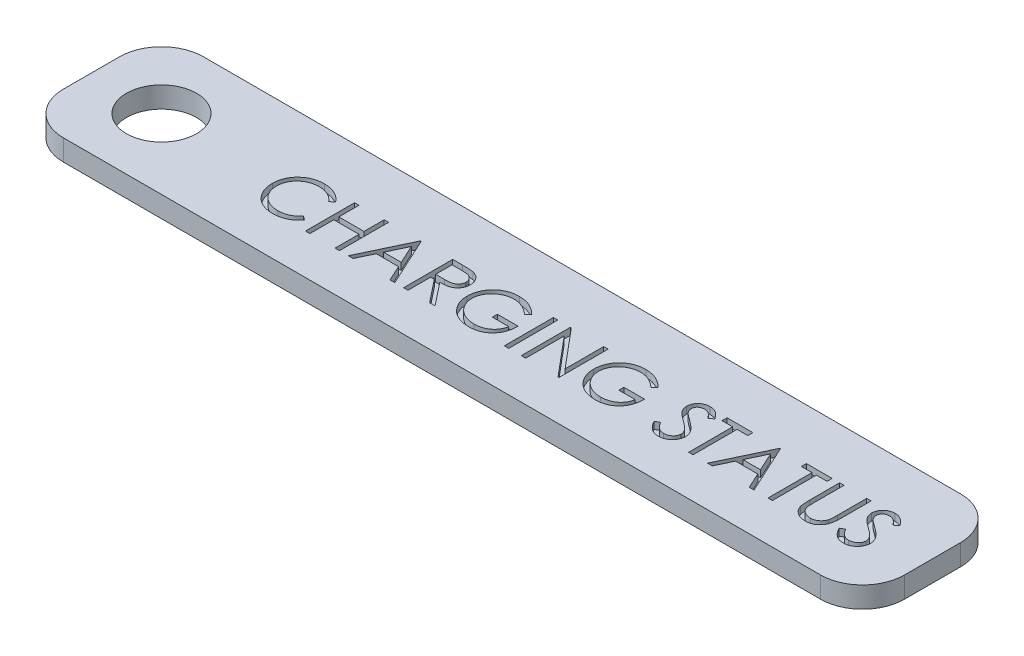
from build123d import *

# Parameters (mm, degrees)
SKETCH1_W           = 60
SKETCH1_H           = 10
BOSS_EXTRUDE1_DEPTH = 1.5
SKETCH4_W           = 0.314102564
SKETCH4_H           = 3.5
CUT_EXTRUDE2_DEPTH  = 0.5
SKETCH5_R           = 2.5
CUT_EXTRUDE3_DEPTH  = 10.5
FILLET1_R           = 3


with BuildPart() as part:
    # Sketch1 → Boss-Extrude1 (new body)
    with BuildSketch(Plane(origin=(0, 0, 0), x_dir=(1, 0, 0), z_dir=(0, 1, 0))):
        with Locations((-30, -5)):
            Rectangle(SKETCH1_W, SKETCH1_H)
    extrude(amount=BOSS_EXTRUDE1_DEPTH)

    # Sketch4 → Cut-Extrude2 (cut)
    # profile 1 of 14: a face of its own
    with BuildSketch(Plane(origin=(0, 1.5, 0), x_dir=(1, 0, 0), z_dir=(0, 1, 0))):
        with BuildLine():
            Line((-43.320512821, -4.267227564), (-43.595352564, -4.477564103))
            add(Edge.make_bspline(
                [(-43.595352564, -4.477564103), (-43.614958452, -4.454198133), (-43.653905899, -4.407781217), (-43.716565102, -4.342601673), (-43.781866745, -4.281536411), (-43.849785866, -4.224294531), (-43.921544985, -4.172877766), (-43.995405784, -4.124606663), (-44.072603829, -4.081338925), (-44.179355564, -4.028875939), (-44.319003412, -3.974129784), (-44.494798251, -3.928226552), (-44.67830935, -3.899005377), (-44.803506949, -3.895840535), (-44.8671875, -3.894230769)],
                knots=[0, 0, 0, 0, 0.757959112, 1.505699292, 2.245454638, 2.979532153, 3.711538275, 4.438200793, 5.171680507, 5.909471876, 7.393775596, 8.890124382, 10.418191784, 12, 12, 12, 12], degree=3))
            add(Edge.make_bspline(
                [(-44.8671875, -3.894230769), (-44.902270799, -3.894634732), (-44.972111792, -3.895438908), (-45.075760265, -3.906048033), (-45.177473317, -3.920959243), (-45.277184783, -3.943084566), (-45.374767741, -3.971057185), (-45.470860143, -4.004482599), (-45.564070743, -4.045837439), (-45.655688981, -4.091545699), (-45.743468192, -4.143173144), (-45.82652324, -4.199486496), (-45.904551208, -4.259855592), (-45.97761382, -4.324506698), (-46.045785769, -4.393148659), (-46.108573079, -4.466513), (-46.16575849, -4.544365174), (-46.218475515, -4.625678581), (-46.265688248, -4.710216373), (-46.305218127, -4.798291444), (-46.34022325, -4.888395547), (-46.367922492, -4.981546707), (-46.389847009, -5.077089473), (-46.404974672, -5.175280261), (-46.415463144, -5.275913941), (-46.41626332, -5.344123253), (-46.416666667, -5.378505609)],
                knots=[0, 0, 0, 0, 1.054917814, 2.100044995, 3.131103042, 4.146048494, 5.169673617, 6.183595914, 7.203665975, 8.234915748, 9.262203917, 10.264457458, 11.251630812, 12.227803204, 13.197192746, 14.159520551, 15.12972552, 16.100847026, 17.073214652, 18.039054194, 19.002613845, 19.979014051, 20.95965708, 21.949030935, 22.966165397, 24, 24, 24, 24], degree=3))
            add(Edge.make_bspline(
                [(-46.416666667, -5.378505609), (-46.415404848, -5.430236929), (-46.412927433, -5.531804514), (-46.390879099, -5.680575124), (-46.357374008, -5.823095798), (-46.307158431, -5.95847564), (-46.24523938, -6.088383998), (-46.166998769, -6.210622852), (-46.076382232, -6.327039416), (-45.972107812, -6.434882364), (-45.857701996, -6.533396089), (-45.734954085, -6.620146671), (-45.604169797, -6.692461553), (-45.466793167, -6.7526375), (-45.321767053, -6.798894228), (-45.16935225, -6.831458351), (-45.009880255, -6.852700532), (-44.900910855, -6.85473422), (-44.845452724, -6.855769231)],
                knots=[0, 0, 0, 0, 1.029171465, 2.020641659, 2.987623507, 3.938342917, 4.889210282, 5.84687017, 6.821220943, 7.821438502, 8.827599549, 9.822697543, 10.807740252, 11.797342354, 12.80366471, 13.83203677, 14.896651826, 16, 16, 16, 16], degree=3))
            add(Edge.make_bspline(
                [(-44.845452724, -6.855769231), (-44.784350035, -6.854080451), (-44.664085326, -6.850756528), (-44.4877173, -6.822597279), (-44.318881534, -6.776939362), (-44.157568948, -6.713041439), (-44.004234302, -6.629976151), (-43.858637641, -6.529278274), (-43.720656071, -6.409989941), (-43.637684789, -6.318906813), (-43.595352564, -6.272435897)],
                knots=[0, 0, 0, 0, 1.028121516, 2.023589091, 2.998037872, 3.967518031, 4.937445131, 5.927275754, 6.942489185, 8, 8, 8, 8], degree=3))
            Line((-43.595352564, -6.272435897), (-43.320512821, -6.480669071))
            add(Edge.make_bspline(
                [(-43.320512821, -6.480669071), (-43.34263093, -6.509207522), (-43.386761206, -6.566147729), (-43.458219223, -6.646419438), (-43.53349652, -6.721923474), (-43.61315223, -6.792051095), (-43.696270022, -6.858205561), (-43.784342334, -6.918507392), (-43.876211366, -6.973798276), (-43.971565845, -7.024425201), (-44.070304458, -7.069342448), (-44.172308893, -7.107796216), (-44.277139469, -7.140921105), (-44.384800977, -7.168173042), (-44.495516734, -7.189444126), (-44.608887208, -7.203663801), (-44.725157083, -7.213405715), (-44.803598504, -7.214293631), (-44.843349359, -7.21474359)],
                knots=[0, 0, 0, 0, 0.986787822, 1.968848986, 2.935600012, 3.899624008, 4.868462664, 5.837806735, 6.815139263, 7.798259679, 8.787526145, 9.778297419, 10.776456485, 11.791383307, 12.812564526, 13.85620153, 14.913611965, 16, 16, 16, 16], degree=3))
            add(Edge.make_bspline(
                [(-44.843349359, -7.21474359), (-44.880993026, -7.214481597), (-44.955428716, -7.213963539), (-45.065327468, -7.205571372), (-45.172317049, -7.194121635), (-45.276091674, -7.176881504), (-45.377217649, -7.156537164), (-45.474778234, -7.129265907), (-45.569733444, -7.098716741), (-45.661701785, -7.062811754), (-45.750761485, -7.022295571), (-45.836625296, -6.976504013), (-45.919253729, -6.925822148), (-45.999459149, -6.871367137), (-46.076056733, -6.811389836), (-46.149710258, -6.746723201), (-46.220832735, -6.67758519), (-46.26483542, -6.627730337), (-46.286959135, -6.602664263)],
                knots=[0, 0, 0, 0, 1.114604814, 2.203992996, 3.262667896, 4.300477797, 5.318619304, 6.316056647, 7.298880507, 8.271930387, 9.238335007, 10.195173496, 11.151986948, 12.108099108, 13.064862484, 14.031167946, 15.010108607, 16, 16, 16, 16], degree=3))
            add(Edge.make_bspline(
                [(-46.286959135, -6.602664263), (-46.322394778, -6.559123074), (-46.392838255, -6.472566363), (-46.482963938, -6.332280382), (-46.560111494, -6.185812173), (-46.622487414, -6.032392245), (-46.671250148, -5.872364857), (-46.705031343, -5.705649343), (-46.726982947, -5.532401401), (-46.729493236, -5.414564612), (-46.730769231, -5.354667468)],
                knots=[0, 0, 0, 0, 0.994628077, 1.977248131, 2.950237994, 3.925870899, 4.908910175, 5.911660606, 6.938484602, 8, 8, 8, 8], degree=3))
            add(Edge.make_bspline(
                [(-46.730769231, -5.354667468), (-46.729214037, -5.291712014), (-46.726154291, -5.16785109), (-46.700158496, -4.986077137), (-46.658339699, -4.811925738), (-46.598942811, -4.645721993), (-46.523637459, -4.486591713), (-46.430610846, -4.335750508), (-46.320943703, -4.192233708), (-46.195496136, -4.058218957), (-46.0579288, -3.935679604), (-45.910609986, -3.827873401), (-45.75382804, -3.738155885), (-45.589310188, -3.663159722), (-45.415824506, -3.605515259), (-45.233741137, -3.565162072), (-45.043402222, -3.540044956), (-44.913539797, -3.536869748), (-44.84755609, -3.53525641)],
                knots=[0, 0, 0, 0, 1.032925535, 2.032216505, 3.007276963, 3.968222605, 4.92396291, 5.891752235, 6.871517503, 7.883894988, 8.900124299, 9.891468569, 10.874487609, 11.85992873, 12.854644235, 13.869047385, 14.917252991, 16, 16, 16, 16], degree=3))
            add(Edge.make_bspline(
                [(-44.84755609, -3.53525641), (-44.807341618, -3.535738548), (-44.727741121, -3.536692892), (-44.609988468, -3.545999035), (-44.495346141, -3.561512641), (-44.383735159, -3.582628711), (-44.274612543, -3.608836032), (-44.168812302, -3.64297633), (-44.065713615, -3.682012862), (-43.965966707, -3.726971328), (-43.870050157, -3.777438069), (-43.777993838, -3.832853693), (-43.69052898, -3.893149498), (-43.607040131, -3.957812674), (-43.52892392, -4.028211233), (-43.453962442, -4.102408829), (-43.384701363, -4.182542653), (-43.341948168, -4.238947587), (-43.320512821, -4.267227564)],
                knots=[0, 0, 0, 0, 1.096760587, 2.17092713, 3.219439832, 4.250915756, 5.268269357, 6.278326846, 7.281116186, 8.274029601, 9.260640565, 10.235837813, 11.203064059, 12.156899882, 13.114053108, 14.069676657, 15.032185724, 16, 16, 16, 16], degree=3))
        make_face()
    # profile 2 of 14: a face of its own
    with BuildSketch(Plane(origin=(0, 1.5, 0), x_dir=(1, 0, 0), z_dir=(0, 1, 0))):
        Polygon((-42.602564103, -3.625), (-42.288461538, -3.625), (-42.288461538, -5.060897436), (-40.493589744, -5.060897436), (-40.493589744, -3.625), (-40.179487179, -3.625), (-40.179487179, -7.125), (-40.493589744, -7.125), (-40.493589744, -5.419871795), (-42.288461538, -5.419871795), (-42.288461538, -7.125), (-42.602564103, -7.125), align=None)
    # profile 3 of 14: a face of its own
    with BuildSketch(Plane(origin=(0, 1.5, 0), x_dir=(1, 0, 0), z_dir=(0, 1, 0))):
        Polygon((-37.846153846, -3.625), (-36.230769231, -7.125), (-36.572215545, -7.125), (-37.089643429, -6.003205128), (-38.676282051, -6.003205128), (-39.208433494, -7.125), (-39.551282051, -7.125), (-37.891025641, -3.625), align=None)
        Polygon((-37.872095353, -4.307191506), (-38.505909455, -5.644230769), (-37.255108173, -5.644230769), align=None, mode=Mode.SUBTRACT)
    # profile 4 of 14: a face of its own
    with BuildSketch(Plane(origin=(0, 1.5, 0), x_dir=(1, 0, 0), z_dir=(0, 1, 0))):
        with BuildLine():
            Line((-35.602564103, -3.625), (-34.902143429, -3.625))
            add(Edge.make_bspline(
                [(-34.902143429, -3.625), (-34.855402301, -3.625155586), (-34.765654157, -3.625454328), (-34.637080886, -3.627120091), (-34.520253789, -3.631894447), (-34.41523395, -3.63600303), (-34.322023295, -3.643494972), (-34.240336004, -3.650655619), (-34.170548307, -3.66002928), (-34.128302455, -3.668734703), (-34.109174679, -3.672676282)],
                knots=[0, 0, 0, 0, 1.410062039, 2.707475311, 3.878576406, 4.937260626, 5.877586885, 6.699081471, 7.410979367, 8, 8, 8, 8], degree=3))
            add(Edge.make_bspline(
                [(-34.109174679, -3.672676282), (-34.083568055, -3.679003047), (-34.032901066, -3.691521611), (-33.959951, -3.717981212), (-33.890436676, -3.748600837), (-33.824646852, -3.784564557), (-33.76291106, -3.826139337), (-33.70459275, -3.872607459), (-33.649427286, -3.923714665), (-33.599645656, -3.980749506), (-33.552706604, -4.040586016), (-33.513117978, -4.105289773), (-33.478991498, -4.1729513), (-33.451820981, -4.244258718), (-33.429943008, -4.31852049), (-33.414516768, -4.396409287), (-33.405265581, -4.477570262), (-33.404323725, -4.53292817), (-33.403846154, -4.560997596)],
                knots=[0, 0, 0, 0, 1.027469482, 2.033020251, 3.019912614, 3.986113645, 4.951240523, 5.91722682, 6.890402269, 7.87763091, 8.8651537, 9.85103654, 10.82876324, 11.815024772, 12.821070561, 13.842952187, 14.906261191, 16, 16, 16, 16], degree=3))
            add(Edge.make_bspline(
                [(-33.403846154, -4.560997596), (-33.405315152, -4.607632701), (-33.408181548, -4.698629869), (-33.434906651, -4.83069075), (-33.478683171, -4.953880065), (-33.53900646, -5.068042703), (-33.615825936, -5.170953348), (-33.708150727, -5.261343803), (-33.816032338, -5.336983716), (-33.916461654, -5.389436521), (-34.005175854, -5.423029429), (-34.078209167, -5.446665788), (-34.157876144, -5.464927753), (-34.243413479, -5.481287885), (-34.335177134, -5.49363958), (-34.432947174, -5.502686174), (-34.536793326, -5.508340223), (-34.608132395, -5.509182228), (-34.644831731, -5.509615385)],
                knots=[0, 0, 0, 0, 1.260483769, 2.459530307, 3.627416485, 4.787058657, 5.939039949, 7.08810263, 8.267026773, 9.491475466, 10.141966685, 10.831826277, 11.566392101, 12.351337768, 13.187381173, 14.07005841, 15.007169909, 16, 16, 16, 16], degree=3))
            Line((-34.644831731, -5.509615385), (-33.358974359, -7.125))
            Line((-33.358974359, -7.125), (-33.747395833, -7.125))
            Line((-33.747395833, -7.125), (-35.033253205, -5.509615385))
            Line((-35.033253205, -5.509615385), (-35.288461538, -5.509615385))
            Line((-35.288461538, -5.509615385), (-35.288461538, -7.125))
            Line((-35.288461538, -7.125), (-35.602564103, -7.125))
            Line((-35.602564103, -7.125), (-35.602564103, -3.625))
        make_face()
        with BuildLine():
            Line((-35.288461538, -3.983974359), (-35.288461538, -5.150641026))
            Line((-35.288461538, -5.150641026), (-34.647636218, -5.155548878))
            add(Edge.make_bspline(
                [(-34.647636218, -5.155548878), (-34.617716179, -5.155562115), (-34.559722622, -5.155587771), (-34.475821957, -5.151593995), (-34.397701845, -5.147050677), (-34.325661093, -5.140101331), (-34.259667518, -5.13114526), (-34.199754105, -5.119942275), (-34.145823053, -5.106890213), (-34.082924514, -5.086688587), (-34.012687983, -5.054682569), (-33.936356523, -5.00811707), (-33.871354185, -4.949547951), (-33.816436323, -4.882574495), (-33.772306892, -4.808938246), (-33.741194837, -4.729521877), (-33.721452395, -4.646330279), (-33.71912385, -4.589152171), (-33.717948718, -4.560296474)],
                knots=[0, 0, 0, 0, 1.146690395, 2.22261258, 3.21895312, 4.145990853, 4.996080663, 5.770904154, 6.481378293, 7.121626537, 8.300444488, 9.431385265, 10.535395872, 11.636531494, 12.74115979, 13.810798291, 14.895190096, 16, 16, 16, 16], degree=3))
            add(Edge.make_bspline(
                [(-33.717948718, -4.560296474), (-33.719150839, -4.532149901), (-33.721533004, -4.476373662), (-33.740981773, -4.394717752), (-33.773871154, -4.317650802), (-33.818193392, -4.245486317), (-33.872192547, -4.179980581), (-33.93551036, -4.123933428), (-34.006415555, -4.077683963), (-34.072686753, -4.048129582), (-34.131920966, -4.030009729), (-34.183350626, -4.017258565), (-34.241462104, -4.007014096), (-34.306537562, -3.998806036), (-34.378299193, -3.991751091), (-34.457109844, -3.986999313), (-34.542446624, -3.984185449), (-34.601593556, -3.98404636), (-34.632211538, -3.983974359)],
                knots=[0, 0, 0, 0, 1.101028733, 2.181837193, 3.264309656, 4.369019818, 5.486613113, 6.575447106, 7.666700264, 8.788928104, 9.402425223, 10.0903467, 10.862060571, 11.710948788, 12.657782767, 13.684531032, 14.801375019, 16, 16, 16, 16], degree=3))
            Line((-34.632211538, -3.983974359), (-35.288461538, -3.983974359))
        make_face(mode=Mode.SUBTRACT)
    # profile 5 of 14: a face of its own
    with BuildSketch(Plane(origin=(0, 1.5, 0), x_dir=(1, 0, 0), z_dir=(0, 1, 0))):
        with BuildLine():
            Line((-29.365384615, -4.222355769), (-29.634615385, -4.477564103))
            add(Edge.make_bspline(
                [(-29.634615385, -4.477564103), (-29.683334273, -4.43173324), (-29.779610319, -4.341164377), (-29.936570562, -4.223653382), (-30.100334196, -4.122987281), (-30.270046693, -4.041081045), (-30.441505247, -3.975728284), (-30.612434023, -3.929200144), (-30.781079724, -3.899527607), (-30.893246943, -3.895979237), (-30.948517628, -3.894230769)],
                knots=[0, 0, 0, 0, 1.08915593, 2.152340314, 3.188132944, 4.216796309, 5.218260357, 6.173443236, 7.099959455, 8, 8, 8, 8], degree=3))
            add(Edge.make_bspline(
                [(-30.948517628, -3.894230769), (-30.982432328, -3.894644375), (-31.050173769, -3.895470514), (-31.150795713, -3.906014729), (-31.25036235, -3.921179594), (-31.348685725, -3.943121471), (-31.445957011, -3.970930531), (-31.541837903, -4.005715994), (-31.636507258, -4.046271238), (-31.729073339, -4.093133712), (-31.818813842, -4.144613558), (-31.903570678, -4.201662099), (-31.983884077, -4.262450889), (-32.058244502, -4.328501868), (-32.127079689, -4.399216734), (-32.192028061, -4.47328004), (-32.250805357, -4.552715258), (-32.303896522, -4.636060884), (-32.35125814, -4.721853074), (-32.393066794, -4.809266063), (-32.428163882, -4.898009918), (-32.455933337, -4.988195995), (-32.478843991, -5.079126585), (-32.494961598, -5.171431306), (-32.50404832, -5.265208991), (-32.5056201, -5.32800625), (-32.506410256, -5.359575321)],
                knots=[0, 0, 0, 0, 1.02818874, 2.053710826, 3.065248034, 4.081641283, 5.106893873, 6.131558223, 7.173050175, 8.228653731, 9.27666206, 10.308777013, 11.325269123, 12.329503258, 13.32196095, 14.316845687, 15.314881793, 16.315733098, 17.311955233, 18.285320748, 19.252783886, 20.203351036, 21.145449891, 22.095197417, 23.042428769, 24, 24, 24, 24], degree=3))
            add(Edge.make_bspline(
                [(-32.506410256, -5.359575321), (-32.505654538, -5.391846138), (-32.504145165, -5.456299651), (-32.494484846, -5.552493724), (-32.476556605, -5.647259126), (-32.452588896, -5.740907259), (-32.422608081, -5.833598507), (-32.385235415, -5.924931017), (-32.340969814, -6.014901408), (-32.289733262, -6.102699025), (-32.233547059, -6.188222049), (-32.170603978, -6.26878157), (-32.103743394, -6.345450348), (-32.030529494, -6.416526111), (-31.953309952, -6.483910008), (-31.869777676, -6.54574553), (-31.781575216, -6.603223753), (-31.688568004, -6.655620272), (-31.591765221, -6.702428808), (-31.492508468, -6.744052704), (-31.390480653, -6.778332041), (-31.286217963, -6.806270145), (-31.179844691, -6.829170443), (-31.070820889, -6.843902923), (-30.95994818, -6.854593754), (-30.885209548, -6.855375424), (-30.84755609, -6.855769231)],
                knots=[0, 0, 0, 0, 0.93586088, 1.869166235, 2.799637598, 3.729985548, 4.670839027, 5.622275134, 6.589130586, 7.576015415, 8.568469353, 9.55398029, 10.53834874, 11.515998671, 12.510579167, 13.508179873, 14.527009472, 15.561807829, 16.601455013, 17.643573243, 18.680854198, 19.719860599, 20.772568776, 21.833555941, 22.908541556, 24, 24, 24, 24], degree=3))
            add(Edge.make_bspline(
                [(-30.84755609, -6.855769231), (-30.802177743, -6.854820654), (-30.713069985, -6.852957971), (-30.582083543, -6.838457681), (-30.456280472, -6.815810888), (-30.336014269, -6.782644991), (-30.221145248, -6.740341316), (-30.111252307, -6.68934593), (-30.007200648, -6.62770287), (-29.908677474, -6.558129003), (-29.817920289, -6.480614171), (-29.736066165, -6.396969716), (-29.664420676, -6.307601649), (-29.601915976, -6.213036334), (-29.550207322, -6.112491029), (-29.507764527, -6.006458466), (-29.475231235, -5.894890954), (-29.46187626, -5.817799323), (-29.455128205, -5.778846154)],
                knots=[0, 0, 0, 0, 1.13008108, 2.219097802, 3.278683437, 4.311054135, 5.322181354, 6.324827112, 7.324222904, 8.330512327, 9.32562643, 10.293043162, 11.24128371, 12.174520618, 13.111833804, 14.052305215, 15.015860969, 16, 16, 16, 16], degree=3))
            Line((-29.455128205, -5.778846154), (-30.621794872, -5.778846154))
            Line((-30.621794872, -5.778846154), (-30.621794872, -5.419871795))
            Line((-30.621794872, -5.419871795), (-29.141025641, -5.419871795))
            add(Edge.make_bspline(
                [(-29.141025641, -5.419871795), (-29.142731489, -5.486779284), (-29.146070143, -5.617729325), (-29.169489058, -5.808699596), (-29.207305571, -5.98907129), (-29.258965883, -6.159034361), (-29.325841163, -6.318347954), (-29.407213691, -6.46717382), (-29.504385812, -6.604550501), (-29.613896254, -6.731599505), (-29.736796212, -6.844928717), (-29.869764832, -6.944534655), (-30.0130218, -7.02843727), (-30.166431608, -7.096697933), (-30.329492041, -7.149971927), (-30.502580421, -7.187743504), (-30.685462021, -7.210373467), (-30.810798698, -7.213264847), (-30.87489984, -7.21474359)],
                knots=[0, 0, 0, 0, 1.140356446, 2.231883559, 3.274166699, 4.278491846, 5.25512956, 6.21435461, 7.1637429, 8.11826594, 9.068280886, 10.0076534, 10.945064095, 11.891975133, 12.864533718, 13.863980011, 14.907571808, 16, 16, 16, 16], degree=3))
            add(Edge.make_bspline(
                [(-30.87489984, -7.21474359), (-30.914409975, -7.214174469), (-30.992336696, -7.213051978), (-31.107427624, -7.205074631), (-31.219345245, -7.192794054), (-31.328073253, -7.174248931), (-31.434011596, -7.151534277), (-31.536631181, -7.122447558), (-31.636322923, -7.088778859), (-31.733240908, -7.050483185), (-31.826505455, -7.006111528), (-31.916531972, -6.956801889), (-32.003818098, -6.902808528), (-32.087769263, -6.843197682), (-32.168822884, -6.778415222), (-32.246456328, -6.708331303), (-32.321104206, -6.633160184), (-32.367864669, -6.579781174), (-32.391426282, -6.552884615)],
                knots=[0, 0, 0, 0, 1.107784379, 2.184907829, 3.233506516, 4.263428166, 5.276301166, 6.270063455, 7.25232949, 8.225834625, 9.190232166, 10.146266622, 11.1027726, 12.066435141, 13.031522626, 14.010570082, 14.99756817, 16, 16, 16, 16], degree=3))
            add(Edge.make_bspline(
                [(-32.391426282, -6.552884615), (-32.425612214, -6.510213962), (-32.493416627, -6.425580945), (-32.580694783, -6.289981001), (-32.655096186, -6.149579141), (-32.715464008, -6.003984512), (-32.762602095, -5.853333299), (-32.796408347, -5.697818008), (-32.816215636, -5.537238378), (-32.819069174, -5.428573113), (-32.820512821, -5.373597756)],
                knots=[0, 0, 0, 0, 1.023165419, 2.029347347, 3.013907458, 3.994755782, 4.975994455, 5.96558838, 6.970761222, 8, 8, 8, 8], degree=3))
            add(Edge.make_bspline(
                [(-32.820512821, -5.373597756), (-32.819980582, -5.332431504), (-32.818922871, -5.250622196), (-32.806097354, -5.129164889), (-32.787695936, -5.009864197), (-32.760648882, -4.89281764), (-32.726552617, -4.777947049), (-32.683999131, -4.665199085), (-32.634454235, -4.554507213), (-32.576868739, -4.446633345), (-32.512784279, -4.343008932), (-32.443234059, -4.244051129), (-32.367230459, -4.151562064), (-32.286014659, -4.064370416), (-32.198617669, -3.983571569), (-32.105858245, -3.908417458), (-32.007664903, -3.838807272), (-31.903728723, -3.775837438), (-31.795601038, -3.719273817), (-31.683541037, -3.669684605), (-31.567582926, -3.62870129), (-31.448595448, -3.59392751), (-31.325677948, -3.56821237), (-31.199722411, -3.549563624), (-31.070072299, -3.536803025), (-30.982436269, -3.535776769), (-30.938000801, -3.53525641)],
                knots=[0, 0, 0, 0, 1.008945113, 2.00506715, 2.99143336, 3.967273523, 4.948097931, 5.927297278, 6.919902385, 7.919676788, 8.923139349, 9.905703106, 10.883022732, 11.856032218, 12.825136022, 13.798837087, 14.781400844, 15.773989409, 16.776158564, 17.77167057, 18.775803737, 19.789618931, 20.80898985, 21.851988756, 22.910860228, 24, 24, 24, 24], degree=3))
            add(Edge.make_bspline(
                [(-30.938000801, -3.53525641), (-30.901762558, -3.535835902), (-30.829906379, -3.536984966), (-30.722980647, -3.544949614), (-30.617707632, -3.557573495), (-30.513931242, -3.574800282), (-30.412004876, -3.598263972), (-30.31163817, -3.626342257), (-30.212685634, -3.65903408), (-30.115457385, -3.698022926), (-30.019299669, -3.742276551), (-29.923677828, -3.792089973), (-29.828918583, -3.848314978), (-29.734857601, -3.911118513), (-29.640901743, -3.979421931), (-29.548537101, -4.055178755), (-29.455534157, -4.135401511), (-29.395732342, -4.193083695), (-29.365384615, -4.222355769)],
                knots=[0, 0, 0, 0, 0.985871117, 1.954866573, 2.915460327, 3.869826059, 4.81536089, 5.759505086, 6.70452669, 7.649098992, 8.607881297, 9.583363685, 10.581137262, 11.603961102, 12.659522466, 13.73993555, 14.853081303, 16, 16, 16, 16], degree=3))
        make_face()
    # profile 6 of 14: a face of its own
    with BuildSketch(Plane(origin=(0, 1.5, 0), x_dir=(1, 0, 0), z_dir=(0, 1, 0))):
        with Locations((-28.266025641, -5.375)):
            Rectangle(SKETCH4_W, SKETCH4_H)
    # profile 7 of 14: a face of its own
    with BuildSketch(Plane(origin=(0, 1.5, 0), x_dir=(1, 0, 0), z_dir=(0, 1, 0))):
        Polygon((-27.211538462, -7.125), (-27.211538462, -3.625), (-27.145633013, -3.625), (-24.833333333, -6.379707532), (-24.833333333, -3.625), (-24.519230769, -3.625), (-24.519230769, -7.125), (-24.590745192, -7.125), (-26.897435897, -4.376602564), (-26.897435897, -7.125), align=None)
    # profile 8 of 14: a face of its own
    with BuildSketch(Plane(origin=(0, 1.5, 0), x_dir=(1, 0, 0), z_dir=(0, 1, 0))):
        with BuildLine():
            Line((-20.346153846, -4.222355769), (-20.615384615, -4.477564103))
            add(Edge.make_bspline(
                [(-20.615384615, -4.477564103), (-20.664103504, -4.43173324), (-20.76037955, -4.341164377), (-20.917339793, -4.223653382), (-21.081103427, -4.122987281), (-21.250815924, -4.041081045), (-21.422274477, -3.975728284), (-21.593203254, -3.929200144), (-21.761848955, -3.899527607), (-21.874016173, -3.895979237), (-21.929286859, -3.894230769)],
                knots=[0, 0, 0, 0, 1.08915593, 2.152340314, 3.188132944, 4.216796309, 5.218260357, 6.173443236, 7.099959455, 8, 8, 8, 8], degree=3))
            add(Edge.make_bspline(
                [(-21.929286859, -3.894230769), (-21.963201559, -3.894644375), (-22.030943, -3.895470514), (-22.131564944, -3.906014729), (-22.231131581, -3.921179594), (-22.329454955, -3.943121471), (-22.426726242, -3.970930531), (-22.522607134, -4.005715994), (-22.617276489, -4.046271238), (-22.70984257, -4.093133712), (-22.799583073, -4.144613558), (-22.884339909, -4.201662099), (-22.964653308, -4.262450889), (-23.039013733, -4.328501868), (-23.10784892, -4.399216734), (-23.172797292, -4.47328004), (-23.231574588, -4.552715258), (-23.284665753, -4.636060884), (-23.332027371, -4.721853074), (-23.373836024, -4.809266063), (-23.408933113, -4.898009918), (-23.436702568, -4.988195995), (-23.459613222, -5.079126585), (-23.475730829, -5.171431306), (-23.484817551, -5.265208991), (-23.486389331, -5.32800625), (-23.487179487, -5.359575321)],
                knots=[0, 0, 0, 0, 1.02818874, 2.053710826, 3.065248034, 4.081641283, 5.106893873, 6.131558223, 7.173050175, 8.228653731, 9.27666206, 10.308777013, 11.325269123, 12.329503258, 13.32196095, 14.316845687, 15.314881793, 16.315733098, 17.311955233, 18.285320748, 19.252783886, 20.203351036, 21.145449891, 22.095197417, 23.042428769, 24, 24, 24, 24], degree=3))
            add(Edge.make_bspline(
                [(-23.487179487, -5.359575321), (-23.486423769, -5.391846138), (-23.484914396, -5.456299651), (-23.475254076, -5.552493724), (-23.457325836, -5.647259126), (-23.433358127, -5.740907259), (-23.403377311, -5.833598507), (-23.366004645, -5.924931017), (-23.321739045, -6.014901408), (-23.270502493, -6.102699025), (-23.214316289, -6.188222049), (-23.151373208, -6.26878157), (-23.084512625, -6.345450348), (-23.011298725, -6.416526111), (-22.934079183, -6.483910008), (-22.850546907, -6.54574553), (-22.762344446, -6.603223753), (-22.669337234, -6.655620272), (-22.572534452, -6.702428808), (-22.473277699, -6.744052704), (-22.371249883, -6.778332041), (-22.266987194, -6.806270145), (-22.160613922, -6.829170443), (-22.051590119, -6.843902923), (-21.940717411, -6.854593754), (-21.865978779, -6.855375424), (-21.828325321, -6.855769231)],
                knots=[0, 0, 0, 0, 0.93586088, 1.869166235, 2.799637598, 3.729985548, 4.670839027, 5.622275134, 6.589130586, 7.576015415, 8.568469353, 9.55398029, 10.53834874, 11.515998671, 12.510579167, 13.508179873, 14.527009472, 15.561807829, 16.601455013, 17.643573243, 18.680854198, 19.719860599, 20.772568776, 21.833555941, 22.908541556, 24, 24, 24, 24], degree=3))
            add(Edge.make_bspline(
                [(-21.828325321, -6.855769231), (-21.782946973, -6.854820654), (-21.693839216, -6.852957971), (-21.562852773, -6.838457681), (-21.437049703, -6.815810888), (-21.316783499, -6.782644991), (-21.201914479, -6.740341316), (-21.092021537, -6.68934593), (-20.987969879, -6.62770287), (-20.889446705, -6.558129003), (-20.79868952, -6.480614171), (-20.716835396, -6.396969716), (-20.645189906, -6.307601649), (-20.582685207, -6.213036334), (-20.530976553, -6.112491029), (-20.488533758, -6.006458466), (-20.456000466, -5.894890954), (-20.442645491, -5.817799323), (-20.435897436, -5.778846154)],
                knots=[0, 0, 0, 0, 1.13008108, 2.219097802, 3.278683437, 4.311054135, 5.322181354, 6.324827112, 7.324222904, 8.330512327, 9.32562643, 10.293043162, 11.24128371, 12.174520618, 13.111833804, 14.052305215, 15.015860969, 16, 16, 16, 16], degree=3))
            Line((-20.435897436, -5.778846154), (-21.602564103, -5.778846154))
            Line((-21.602564103, -5.778846154), (-21.602564103, -5.419871795))
            Line((-21.602564103, -5.419871795), (-20.121794872, -5.419871795))
            add(Edge.make_bspline(
                [(-20.121794872, -5.419871795), (-20.12350072, -5.486779284), (-20.126839374, -5.617729325), (-20.150258289, -5.808699596), (-20.188074802, -5.98907129), (-20.239735113, -6.159034361), (-20.306610394, -6.318347954), (-20.387982922, -6.46717382), (-20.485155043, -6.604550501), (-20.594665485, -6.731599505), (-20.717565442, -6.844928717), (-20.850534062, -6.944534655), (-20.993791031, -7.02843727), (-21.147200838, -7.096697933), (-21.310261272, -7.149971927), (-21.483349652, -7.187743504), (-21.666231252, -7.210373467), (-21.791567929, -7.213264847), (-21.855669071, -7.21474359)],
                knots=[0, 0, 0, 0, 1.140356446, 2.231883559, 3.274166699, 4.278491846, 5.25512956, 6.21435461, 7.1637429, 8.11826594, 9.068280886, 10.0076534, 10.945064095, 11.891975133, 12.864533718, 13.863980011, 14.907571808, 16, 16, 16, 16], degree=3))
            add(Edge.make_bspline(
                [(-21.855669071, -7.21474359), (-21.895179206, -7.214174469), (-21.973105927, -7.213051978), (-22.088196855, -7.205074631), (-22.200114475, -7.192794054), (-22.308842484, -7.174248931), (-22.414780826, -7.151534277), (-22.517400411, -7.122447558), (-22.617092153, -7.088778859), (-22.714010139, -7.050483185), (-22.807274686, -7.006111528), (-22.897301203, -6.956801889), (-22.984587329, -6.902808528), (-23.068538494, -6.843197682), (-23.149592115, -6.778415222), (-23.227225559, -6.708331303), (-23.301873437, -6.633160184), (-23.3486339, -6.579781174), (-23.372195513, -6.552884615)],
                knots=[0, 0, 0, 0, 1.107784379, 2.184907829, 3.233506516, 4.263428166, 5.276301166, 6.270063455, 7.25232949, 8.225834625, 9.190232166, 10.146266622, 11.1027726, 12.066435141, 13.031522626, 14.010570082, 14.99756817, 16, 16, 16, 16], degree=3))
            add(Edge.make_bspline(
                [(-23.372195513, -6.552884615), (-23.406381445, -6.510213962), (-23.474185857, -6.425580945), (-23.561464014, -6.289981001), (-23.635865417, -6.149579141), (-23.696233239, -6.003984512), (-23.743371325, -5.853333299), (-23.777177578, -5.697818008), (-23.796984867, -5.537238378), (-23.799838405, -5.428573113), (-23.801282051, -5.373597756)],
                knots=[0, 0, 0, 0, 1.023165419, 2.029347347, 3.013907458, 3.994755782, 4.975994455, 5.96558838, 6.970761222, 8, 8, 8, 8], degree=3))
            add(Edge.make_bspline(
                [(-23.801282051, -5.373597756), (-23.800749813, -5.332431504), (-23.799692101, -5.250622196), (-23.786866585, -5.129164889), (-23.768465167, -5.009864197), (-23.741418113, -4.89281764), (-23.707321848, -4.777947049), (-23.664768362, -4.665199085), (-23.615223466, -4.554507213), (-23.55763797, -4.446633345), (-23.49355351, -4.343008932), (-23.42400329, -4.244051129), (-23.34799969, -4.151562064), (-23.26678389, -4.064370416), (-23.1793869, -3.983571569), (-23.086627476, -3.908417458), (-22.988434133, -3.838807272), (-22.884497953, -3.775837438), (-22.776370269, -3.719273817), (-22.664310267, -3.669684605), (-22.548352157, -3.62870129), (-22.429364679, -3.59392751), (-22.306447178, -3.56821237), (-22.180491641, -3.549563624), (-22.050841529, -3.536803025), (-21.9632055, -3.535776769), (-21.918770032, -3.53525641)],
                knots=[0, 0, 0, 0, 1.008945113, 2.00506715, 2.99143336, 3.967273523, 4.948097931, 5.927297278, 6.919902385, 7.919676788, 8.923139349, 9.905703106, 10.883022732, 11.856032218, 12.825136022, 13.798837087, 14.781400844, 15.773989409, 16.776158564, 17.77167057, 18.775803737, 19.789618931, 20.80898985, 21.851988756, 22.910860228, 24, 24, 24, 24], degree=3))
            add(Edge.make_bspline(
                [(-21.918770032, -3.53525641), (-21.882531788, -3.535835902), (-21.81067561, -3.536984966), (-21.703749877, -3.544949614), (-21.598476863, -3.557573495), (-21.494700473, -3.574800282), (-21.392774107, -3.598263972), (-21.292407401, -3.626342257), (-21.193454865, -3.65903408), (-21.096226616, -3.698022926), (-21.0000689, -3.742276551), (-20.904447059, -3.792089973), (-20.809687813, -3.848314978), (-20.715626832, -3.911118513), (-20.621670974, -3.979421931), (-20.529306332, -4.055178755), (-20.436303387, -4.135401511), (-20.376501573, -4.193083695), (-20.346153846, -4.222355769)],
                knots=[0, 0, 0, 0, 0.985871117, 1.954866573, 2.915460327, 3.869826059, 4.81536089, 5.759505086, 6.70452669, 7.649098992, 8.607881297, 9.583363685, 10.581137262, 11.603961102, 12.659522466, 13.73993555, 14.853081303, 16, 16, 16, 16], degree=3))
        make_face()
    # profile 9 of 14: a face of its own
    with BuildSketch(Plane(origin=(0, 1.5, 0), x_dir=(1, 0, 0), z_dir=(0, 1, 0))):
        with BuildLine():
            Line((-18.416666667, -6.449819712), (-18.120793269, -6.272435897))
            add(Edge.make_bspline(
                [(-18.120793269, -6.272435897), (-18.093275032, -6.318500282), (-18.040551151, -6.406757866), (-17.952599792, -6.526015907), (-17.861466881, -6.627378063), (-17.766477547, -6.710254671), (-17.668211599, -6.775503558), (-17.566027546, -6.821705789), (-17.460269735, -6.850521765), (-17.388295913, -6.854021851), (-17.352363782, -6.855769231)],
                knots=[0, 0, 0, 0, 1.272034388, 2.437168799, 3.508375237, 4.49857839, 5.41946034, 6.295179144, 7.148887113, 8, 8, 8, 8], degree=3))
            add(Edge.make_bspline(
                [(-17.352363782, -6.855769231), (-17.321676922, -6.854914558), (-17.260840148, -6.853220168), (-17.171277906, -6.836939366), (-17.084296103, -6.811927237), (-17.001687466, -6.776106306), (-16.924591851, -6.73276782), (-16.856985156, -6.680421642), (-16.798539042, -6.621815437), (-16.750729928, -6.556432782), (-16.714049893, -6.486115633), (-16.685857824, -6.413939682), (-16.670212751, -6.338771114), (-16.667855997, -6.288160651), (-16.666666667, -6.262620192)],
                knots=[0, 0, 0, 0, 1.095163259, 2.171163733, 3.241058638, 4.321873601, 5.38011039, 6.391990106, 7.366004449, 8.327778327, 9.272591725, 10.192022065, 11.087607919, 12, 12, 12, 12], degree=3))
            add(Edge.make_bspline(
                [(-16.666666667, -6.262620192), (-16.668140977, -6.233479343), (-16.671138036, -6.174240253), (-16.696469516, -6.0868406), (-16.736318762, -6.00034803), (-16.773081406, -5.946846765), (-16.792167468, -5.919070513)],
                knots=[0, 0, 0, 0, 0.938893495, 1.908633276, 2.914225137, 4, 4, 4, 4], degree=3))
            add(Edge.make_bspline(
                [(-16.792167468, -5.919070513), (-16.807838082, -5.899023689), (-16.840736576, -5.856937891), (-16.897294089, -5.794292655), (-16.963660203, -5.729674236), (-17.037563758, -5.660615179), (-17.121696847, -5.590327383), (-17.213424361, -5.515459105), (-17.31508822, -5.438857528), (-17.386387717, -5.387484962), (-17.423177083, -5.360977564)],
                knots=[0, 0, 0, 0, 0.722233717, 1.516239348, 2.393582979, 3.351407094, 4.387010283, 5.505090956, 6.712668013, 8, 8, 8, 8], degree=3))
            add(Edge.make_bspline(
                [(-17.423177083, -5.360977564), (-17.46000108, -5.334748976), (-17.530405756, -5.284601914), (-17.628864338, -5.21017763), (-17.716908801, -5.142133761), (-17.794147818, -5.079829749), (-17.860547415, -5.023257144), (-17.916630826, -4.972959205), (-17.960969383, -4.927575644), (-17.985624964, -4.898134302), (-17.996694712, -4.884915865)],
                knots=[0, 0, 0, 0, 1.452282411, 2.77665338, 3.964542531, 5.026858415, 5.96415736, 6.766646006, 7.446254459, 8, 8, 8, 8], degree=3))
            add(Edge.make_bspline(
                [(-17.996694712, -4.884915865), (-18.012167257, -4.864314829), (-18.042596093, -4.823800125), (-18.082762099, -4.760475267), (-18.116901262, -4.695652002), (-18.143663594, -4.629156137), (-18.166199813, -4.561921208), (-18.181357743, -4.493069962), (-18.19084914, -4.422911344), (-18.191821127, -4.375697843), (-18.192307692, -4.352063301)],
                knots=[0, 0, 0, 0, 1.068054152, 2.10047183, 3.106115577, 4.101338837, 5.06977816, 6.043150881, 7.020423561, 8, 8, 8, 8], degree=3))
            add(Edge.make_bspline(
                [(-18.192307692, -4.352063301), (-18.191002483, -4.315033527), (-18.188419963, -4.241765463), (-18.166579446, -4.134734633), (-18.132106552, -4.032548215), (-18.083811664, -3.936217882), (-18.021554312, -3.848251901), (-17.949508337, -3.767638414), (-17.863696851, -3.699869832), (-17.769544228, -3.640657773), (-17.666487856, -3.594311848), (-17.558496952, -3.559350868), (-17.44539988, -3.53954161), (-17.368796746, -3.536698845), (-17.329927885, -3.53525641)],
                knots=[0, 0, 0, 0, 1.005424448, 1.989358655, 2.955360095, 3.929531133, 4.905563448, 5.876582895, 6.856512386, 7.866279853, 8.892233794, 9.918561126, 10.94386622, 12, 12, 12, 12], degree=3))
            add(Edge.make_bspline(
                [(-17.329927885, -3.53525641), (-17.288683784, -3.536678962), (-17.206662433, -3.539507963), (-17.086013217, -3.564105494), (-16.969852501, -3.604806166), (-16.876409236, -3.650994824), (-16.803276474, -3.69712624), (-16.747503742, -3.739146064), (-16.690986291, -3.787521173), (-16.633268236, -3.842380419), (-16.575327577, -3.90422717), (-16.516304124, -3.972637859), (-16.456059856, -4.047194415), (-16.417303995, -4.100418915), (-16.397435897, -4.127704327)],
                knots=[0, 0, 0, 0, 1.286793592, 2.559021753, 3.825965368, 5.121522368, 5.803751409, 6.523245864, 7.299691795, 8.125521123, 9.008227632, 9.944561021, 10.946284179, 12, 12, 12, 12], degree=3))
            Line((-16.397435897, -4.127704327), (-16.681390224, -4.342948718))
            add(Edge.make_bspline(
                [(-16.681390224, -4.342948718), (-16.698536157, -4.320860028), (-16.731555214, -4.278322374), (-16.781684701, -4.218751059), (-16.828933349, -4.164334579), (-16.875483748, -4.117069451), (-16.91887738, -4.074367318), (-16.960994422, -4.037807561), (-17.001228773, -4.007031966), (-17.051945684, -3.974188406), (-17.115663402, -3.941631902), (-17.195647939, -3.914082824), (-17.279234214, -3.897527762), (-17.336163845, -3.895338874), (-17.364983974, -3.894230769)],
                knots=[0, 0, 0, 0, 1.181633172, 2.275549214, 3.290209073, 4.226197932, 5.078386478, 5.862611352, 6.581680152, 7.217281963, 8.414376989, 9.595101626, 10.782541182, 12, 12, 12, 12], degree=3))
            add(Edge.make_bspline(
                [(-17.364983974, -3.894230769), (-17.401140497, -3.895442469), (-17.470864944, -3.897779118), (-17.56985518, -3.923299104), (-17.658949105, -3.963480964), (-17.73550167, -4.019795942), (-17.799238647, -4.086516935), (-17.845344106, -4.16329579), (-17.873094271, -4.248078192), (-17.87648055, -4.307219849), (-17.878205128, -4.337339744)],
                knots=[0, 0, 0, 0, 1.14458467, 2.207223713, 3.21896685, 4.227309161, 5.202851033, 6.127160689, 7.046193047, 8, 8, 8, 8], degree=3))
            add(Edge.make_bspline(
                [(-17.878205128, -4.337339744), (-17.877812002, -4.356091222), (-17.877025105, -4.393624842), (-17.866050308, -4.449076264), (-17.851950979, -4.504387603), (-17.829608347, -4.559310186), (-17.798763043, -4.614804545), (-17.758257868, -4.671826282), (-17.707244555, -4.730877991), (-17.668167543, -4.769285365), (-17.647536058, -4.789563301)],
                knots=[0, 0, 0, 0, 0.858281714, 1.717966888, 2.583508476, 3.4729293, 4.427298488, 5.488583878, 6.674047936, 8, 8, 8, 8], degree=3))
            add(Edge.make_bspline(
                [(-17.647536058, -4.789563301), (-17.639874685, -4.796400327), (-17.621673018, -4.812643535), (-17.588397092, -4.839235816), (-17.544454294, -4.872038588), (-17.490992093, -4.912625905), (-17.427024731, -4.959707367), (-17.352545175, -5.012680979), (-17.268383642, -5.073266438), (-17.208661726, -5.115623979), (-17.177083333, -5.138020833)],
                knots=[0, 0, 0, 0, 0.420754252, 0.999615792, 1.744751191, 2.668019286, 3.750313428, 4.999500688, 6.413464383, 8, 8, 8, 8], degree=3))
            add(Edge.make_bspline(
                [(-17.177083333, -5.138020833), (-17.13909742, -5.165662193), (-17.065542964, -5.219185855), (-16.960885384, -5.299601535), (-16.865991576, -5.378249303), (-16.780528372, -5.45462691), (-16.703651464, -5.528155003), (-16.636213743, -5.599718184), (-16.577528063, -5.668803756), (-16.514348844, -5.757376332), (-16.449791025, -5.866157416), (-16.394349517, -5.999435655), (-16.35939117, -6.133231975), (-16.354819654, -6.223158812), (-16.352564103, -6.267528045)],
                knots=[0, 0, 0, 0, 1.163667725, 2.253281268, 3.268753668, 4.215851969, 5.092017293, 5.902905408, 6.650798638, 7.335211899, 8.59617414, 9.77448103, 10.901945474, 12, 12, 12, 12], degree=3))
            add(Edge.make_bspline(
                [(-16.352564103, -6.267528045), (-16.353221241, -6.29890641), (-16.354522756, -6.361053794), (-16.36948367, -6.45230887), (-16.391403335, -6.54093974), (-16.424440569, -6.625850853), (-16.464763727, -6.708595615), (-16.515929975, -6.787003516), (-16.57523766, -6.862809914), (-16.643271424, -6.933993406), (-16.717717327, -6.999339602), (-16.796401021, -7.057468663), (-16.879451294, -7.105936986), (-16.966417611, -7.145487828), (-17.057319948, -7.176421346), (-17.152127732, -7.198834215), (-17.250997243, -7.212589926), (-17.318197724, -7.214017687), (-17.352363782, -7.21474359)],
                knots=[0, 0, 0, 0, 0.983748083, 1.948392443, 2.894712957, 3.844097841, 4.80183111, 5.778335162, 6.776009319, 7.81870978, 8.863265674, 9.881300176, 10.883814829, 11.87499822, 12.874611388, 13.892143829, 14.928324115, 16, 16, 16, 16], degree=3))
            add(Edge.make_bspline(
                [(-17.352363782, -7.21474359), (-17.378799125, -7.214232408), (-17.431336885, -7.213216483), (-17.509046367, -7.204235202), (-17.585185956, -7.191528099), (-17.658800238, -7.171354029), (-17.73083765, -7.146877052), (-17.800984884, -7.116738719), (-17.869275938, -7.080621518), (-17.936093521, -7.039326493), (-18.001267696, -6.991268748), (-18.064187164, -6.935295252), (-18.126916349, -6.872949747), (-18.187603745, -6.802539184), (-18.24747689, -6.725201101), (-18.305355299, -6.640211917), (-18.362437017, -6.548034564), (-18.398252485, -6.483169478), (-18.416666667, -6.449819712)],
                knots=[0, 0, 0, 0, 0.915332311, 1.819136955, 2.706846663, 3.586547465, 4.459518054, 5.340707479, 6.227863349, 7.133153174, 8.059268498, 9.028702269, 10.047606654, 11.120612155, 12.245963614, 13.433783089, 14.680604001, 16, 16, 16, 16], degree=3))
        make_face()
    # profile 10 of 14: a face of its own
    with BuildSketch(Plane(origin=(0, 1.5, 0), x_dir=(1, 0, 0), z_dir=(0, 1, 0))):
        Polygon((-16.038461538, -3.983974359), (-16.038461538, -3.625), (-14.198717949, -3.625), (-14.198717949, -3.983974359), (-14.961538462, -3.983974359), (-14.961538462, -7.125), (-15.275641026, -7.125), (-15.275641026, -3.983974359), align=None)
    # profile 11 of 14: a face of its own
    with BuildSketch(Plane(origin=(0, 1.5, 0), x_dir=(1, 0, 0), z_dir=(0, 1, 0))):
        Polygon((-12.224358974, -3.625), (-10.608974359, -7.125), (-10.950420673, -7.125), (-11.467848558, -6.003205128), (-13.054487179, -6.003205128), (-13.586638622, -7.125), (-13.929487179, -7.125), (-12.269230769, -3.625), align=None)
        Polygon((-12.250300481, -4.307191506), (-12.884114583, -5.644230769), (-11.633313301, -5.644230769), align=None, mode=Mode.SUBTRACT)
    # profile 12 of 14: a face of its own
    with BuildSketch(Plane(origin=(0, 1.5, 0), x_dir=(1, 0, 0), z_dir=(0, 1, 0))):
        Polygon((-10.384615385, -3.983974359), (-10.384615385, -3.625), (-8.544871795, -3.625), (-8.544871795, -3.983974359), (-9.307692308, -3.983974359), (-9.307692308, -7.125), (-9.621794872, -7.125), (-9.621794872, -3.983974359), align=None)
    # profile 13 of 14: a face of its own
    with BuildSketch(Plane(origin=(0, 1.5, 0), x_dir=(1, 0, 0), z_dir=(0, 1, 0))):
        with BuildLine():
            Line((-8.006410256, -3.625), (-7.692307692, -3.625))
            Line((-7.692307692, -3.625), (-7.692307692, -5.722055288))
            add(Edge.make_bspline(
                [(-7.692307692, -5.722055288), (-7.692354436, -5.751736024), (-7.692443141, -5.808060335), (-7.691850627, -5.888228636), (-7.690191259, -5.959501095), (-7.689145099, -6.022152442), (-7.686817766, -6.07589519), (-7.684919719, -6.1210205), (-7.682479162, -6.157314703), (-7.679546045, -6.178495629), (-7.678285256, -6.18760016)],
                knots=[0, 0, 0, 0, 1.528628734, 2.90083645, 4.128790002, 5.200304208, 6.127813768, 6.898992206, 7.526736466, 8, 8, 8, 8], degree=3))
            add(Edge.make_bspline(
                [(-7.678285256, -6.18760016), (-7.673107798, -6.220446924), (-7.663044611, -6.284289653), (-7.637398233, -6.375197935), (-7.601580732, -6.457129393), (-7.55913769, -6.532640684), (-7.503205078, -6.599630044), (-7.436201543, -6.661341697), (-7.355023775, -6.715313501), (-7.264763169, -6.764664313), (-7.167477931, -6.804329396), (-7.068066665, -6.83432276), (-6.968023686, -6.85260166), (-6.901047521, -6.854718199), (-6.867788462, -6.855769231)],
                knots=[0, 0, 0, 0, 1.035780045, 2.013197591, 2.933192213, 3.817615948, 4.702609284, 5.640816605, 6.646850145, 7.73207398, 8.84249596, 9.914020372, 10.964143139, 12, 12, 12, 12], degree=3))
            add(Edge.make_bspline(
                [(-6.867788462, -6.855769231), (-6.839234721, -6.85469538), (-6.782292159, -6.852553882), (-6.697685729, -6.839292451), (-6.61528562, -6.815391885), (-6.53468494, -6.784552127), (-6.459133956, -6.743804536), (-6.388590514, -6.696733697), (-6.325626579, -6.64152282), (-6.268168582, -6.580422476), (-6.218133646, -6.511482676), (-6.174762504, -6.436204538), (-6.139236574, -6.353455191), (-6.12169305, -6.295300769), (-6.112680288, -6.265424679)],
                knots=[0, 0, 0, 0, 0.994687771, 1.983630487, 2.973142513, 3.978332533, 4.983357753, 5.956394766, 6.925816176, 7.893390482, 8.871859704, 9.88551698, 10.913711441, 12, 12, 12, 12], degree=3))
            add(Edge.make_bspline(
                [(-6.112680288, -6.265424679), (-6.109680163, -6.253076105), (-6.102994675, -6.225558505), (-6.09674763, -6.179037215), (-6.090241105, -6.124147851), (-6.085726535, -6.060496038), (-6.081325314, -5.988295065), (-6.078692241, -5.907168808), (-6.077475208, -5.817411847), (-6.077112528, -5.754774685), (-6.076923077, -5.722055288)],
                knots=[0, 0, 0, 0, 0.558680831, 1.244966039, 2.062412453, 2.990489873, 4.051219941, 5.244515665, 6.560634259, 8, 8, 8, 8], degree=3))
            Line((-6.076923077, -5.722055288), (-6.076923077, -3.625))
            Line((-6.076923077, -3.625), (-5.762820513, -3.625))
            Line((-5.762820513, -3.625), (-5.762820513, -5.738882212))
            add(Edge.make_bspline(
                [(-5.762820513, -5.738882212), (-5.763074633, -5.77698059), (-5.763570565, -5.851331893), (-5.767871141, -5.960283252), (-5.774728141, -6.063636234), (-5.784416229, -6.16140473), (-5.797253232, -6.253238889), (-5.811528453, -6.339943658), (-5.829707986, -6.42089665), (-5.850941387, -6.496729068), (-5.875214935, -6.568914581), (-5.906656083, -6.637423196), (-5.942080583, -6.704337596), (-5.984095236, -6.768645705), (-6.031306619, -6.830632258), (-6.084758299, -6.889921333), (-6.14268246, -6.947460379), (-6.20604202, -7.001773445), (-6.273792545, -7.051582122), (-6.345732503, -7.095379893), (-6.421309273, -7.132403511), (-6.500326399, -7.162879435), (-6.582817602, -7.185794034), (-6.668784961, -7.20286919), (-6.758424155, -7.212571487), (-6.819388811, -7.214013418), (-6.850260417, -7.21474359)],
                knots=[0, 0, 0, 0, 1.316592851, 2.569410997, 3.76748051, 4.895814652, 5.963796859, 6.97159953, 7.931736103, 8.829262218, 9.692595152, 10.560224239, 11.431080259, 12.30701507, 13.211635791, 14.121146779, 15.063487852, 16.031507147, 17.00238618, 17.966455255, 18.938106653, 19.907068911, 20.888905087, 21.893141452, 22.933117798, 24, 24, 24, 24], degree=3))
            add(Edge.make_bspline(
                [(-6.850260417, -7.21474359), (-6.883929519, -7.213958824), (-6.949988178, -7.212419118), (-7.047326245, -7.203596368), (-7.140640442, -7.186977973), (-7.230916319, -7.16581803), (-7.316924816, -7.136634292), (-7.39981826, -7.102536168), (-7.478176941, -7.060658907), (-7.55327207, -7.014065514), (-7.623096826, -6.961640876), (-7.687194229, -6.904500702), (-7.7456701, -6.843560325), (-7.797538796, -6.778159959), (-7.843659681, -6.708808252), (-7.883389894, -6.635309012), (-7.917503138, -6.557690696), (-7.935109705, -6.503737496), (-7.944010417, -6.47646234)],
                knots=[0, 0, 0, 0, 1.13879206, 2.234305948, 3.301075583, 4.341971843, 5.366689343, 6.369221514, 7.369726634, 8.367512178, 9.355451585, 10.318319045, 11.268648973, 12.207971039, 13.137398894, 14.081662264, 15.030215811, 16, 16, 16, 16], degree=3))
            add(Edge.make_bspline(
                [(-7.944010417, -6.47646234), (-7.949187575, -6.457829765), (-7.960416946, -6.417415296), (-7.972442244, -6.350528808), (-7.982551326, -6.27351389), (-7.992056884, -6.186365272), (-7.997665842, -6.089015405), (-8.00258328, -5.981506489), (-8.006444899, -5.863708528), (-8.006422127, -5.781654012), (-8.006410256, -5.738882212)],
                knots=[0, 0, 0, 0, 0.625038921, 1.35572334, 2.194682327, 3.136881307, 4.189498639, 5.346923369, 6.617055217, 8, 8, 8, 8], degree=3))
            Line((-8.006410256, -5.738882212), (-8.006410256, -3.625))
        make_face()
    # profile 14 of 14: a face of its own
    with BuildSketch(Plane(origin=(0, 1.5, 0), x_dir=(1, 0, 0), z_dir=(0, 1, 0))):
        with BuildLine():
            Line((-5.224358974, -6.449819712), (-4.928485577, -6.272435897))
            add(Edge.make_bspline(
                [(-4.928485577, -6.272435897), (-4.90096734, -6.318500282), (-4.848243459, -6.406757866), (-4.7602921, -6.526015907), (-4.669159189, -6.627378063), (-4.574169855, -6.710254671), (-4.475903907, -6.775503558), (-4.373719853, -6.821705789), (-4.267962043, -6.850521765), (-4.195988221, -6.854021851), (-4.16005609, -6.855769231)],
                knots=[0, 0, 0, 0, 1.272034388, 2.437168799, 3.508375237, 4.49857839, 5.41946034, 6.295179144, 7.148887113, 8, 8, 8, 8], degree=3))
            add(Edge.make_bspline(
                [(-4.16005609, -6.855769231), (-4.129369229, -6.854914558), (-4.068532456, -6.853220168), (-3.978970213, -6.836939366), (-3.891988411, -6.811927237), (-3.809379773, -6.776106306), (-3.732284159, -6.73276782), (-3.664677463, -6.680421642), (-3.60623135, -6.621815437), (-3.558422236, -6.556432782), (-3.5217422, -6.486115633), (-3.493550132, -6.413939682), (-3.477905058, -6.338771114), (-3.475548305, -6.288160651), (-3.474358974, -6.262620192)],
                knots=[0, 0, 0, 0, 1.095163259, 2.171163733, 3.241058638, 4.321873601, 5.38011039, 6.391990106, 7.366004449, 8.327778327, 9.272591725, 10.192022065, 11.087607919, 12, 12, 12, 12], degree=3))
            add(Edge.make_bspline(
                [(-3.474358974, -6.262620192), (-3.475833285, -6.233479343), (-3.478830343, -6.174240253), (-3.504161823, -6.0868406), (-3.54401107, -6.00034803), (-3.580773714, -5.946846765), (-3.599859776, -5.919070513)],
                knots=[0, 0, 0, 0, 0.938893495, 1.908633276, 2.914225137, 4, 4, 4, 4], degree=3))
            add(Edge.make_bspline(
                [(-3.599859776, -5.919070513), (-3.61553039, -5.899023689), (-3.648428884, -5.856937891), (-3.704986397, -5.794292655), (-3.771352511, -5.729674236), (-3.845256066, -5.660615179), (-3.929389155, -5.590327383), (-4.021116669, -5.515459105), (-4.122780528, -5.438857528), (-4.194080025, -5.387484962), (-4.230869391, -5.360977564)],
                knots=[0, 0, 0, 0, 0.722233717, 1.516239348, 2.393582979, 3.351407094, 4.387010283, 5.505090956, 6.712668013, 8, 8, 8, 8], degree=3))
            add(Edge.make_bspline(
                [(-4.230869391, -5.360977564), (-4.267693387, -5.334748976), (-4.338098064, -5.284601914), (-4.436556646, -5.21017763), (-4.524601109, -5.142133761), (-4.601840126, -5.079829749), (-4.668239723, -5.023257144), (-4.724323134, -4.972959205), (-4.768661691, -4.927575644), (-4.793317271, -4.898134302), (-4.804387019, -4.884915865)],
                knots=[0, 0, 0, 0, 1.452282411, 2.77665338, 3.964542531, 5.026858415, 5.96415736, 6.766646006, 7.446254459, 8, 8, 8, 8], degree=3))
            add(Edge.make_bspline(
                [(-4.804387019, -4.884915865), (-4.819859564, -4.864314829), (-4.850288401, -4.823800125), (-4.890454407, -4.760475267), (-4.924593569, -4.695652002), (-4.951355902, -4.629156137), (-4.97389212, -4.561921208), (-4.989050051, -4.493069962), (-4.998541448, -4.422911344), (-4.999513435, -4.375697843), (-5, -4.352063301)],
                knots=[0, 0, 0, 0, 1.068054152, 2.10047183, 3.106115577, 4.101338837, 5.06977816, 6.043150881, 7.020423561, 8, 8, 8, 8], degree=3))
            add(Edge.make_bspline(
                [(-5, -4.352063301), (-4.998694791, -4.315033527), (-4.996112271, -4.241765463), (-4.974271754, -4.134734633), (-4.93979886, -4.032548215), (-4.891503972, -3.936217882), (-4.829246619, -3.848251901), (-4.757200645, -3.767638414), (-4.671389159, -3.699869832), (-4.577236535, -3.640657773), (-4.474180163, -3.594311848), (-4.36618926, -3.559350868), (-4.253092188, -3.53954161), (-4.176489053, -3.536698845), (-4.137620192, -3.53525641)],
                knots=[0, 0, 0, 0, 1.005424448, 1.989358655, 2.955360095, 3.929531133, 4.905563448, 5.876582895, 6.856512386, 7.866279853, 8.892233794, 9.918561126, 10.94386622, 12, 12, 12, 12], degree=3))
            add(Edge.make_bspline(
                [(-4.137620192, -3.53525641), (-4.096376092, -3.536678962), (-4.01435474, -3.539507963), (-3.893705525, -3.564105494), (-3.777544808, -3.604806166), (-3.684101543, -3.650994824), (-3.610968782, -3.69712624), (-3.555196049, -3.739146064), (-3.498678599, -3.787521173), (-3.440960544, -3.842380419), (-3.383019884, -3.90422717), (-3.323996432, -3.972637859), (-3.263752163, -4.047194415), (-3.224996303, -4.100418915), (-3.205128205, -4.127704327)],
                knots=[0, 0, 0, 0, 1.286793592, 2.559021753, 3.825965368, 5.121522368, 5.803751409, 6.523245864, 7.299691795, 8.125521123, 9.008227632, 9.944561021, 10.946284179, 12, 12, 12, 12], degree=3))
            Line((-3.205128205, -4.127704327), (-3.489082532, -4.342948718))
            add(Edge.make_bspline(
                [(-3.489082532, -4.342948718), (-3.506228465, -4.320860028), (-3.539247522, -4.278322374), (-3.589377008, -4.218751059), (-3.636625656, -4.164334579), (-3.683176056, -4.117069451), (-3.726569688, -4.074367318), (-3.76868673, -4.037807561), (-3.808921081, -4.007031966), (-3.859637992, -3.974188406), (-3.92335571, -3.941631902), (-4.003340246, -3.914082824), (-4.086926521, -3.897527762), (-4.143856153, -3.895338874), (-4.172676282, -3.894230769)],
                knots=[0, 0, 0, 0, 1.181633172, 2.275549214, 3.290209073, 4.226197932, 5.078386478, 5.862611352, 6.581680152, 7.217281963, 8.414376989, 9.595101626, 10.782541182, 12, 12, 12, 12], degree=3))
            add(Edge.make_bspline(
                [(-4.172676282, -3.894230769), (-4.208832804, -3.895442469), (-4.278557252, -3.897779118), (-4.377547488, -3.923299104), (-4.466641413, -3.963480964), (-4.543193978, -4.019795942), (-4.606930955, -4.086516935), (-4.653036414, -4.16329579), (-4.680786578, -4.248078192), (-4.684172858, -4.307219849), (-4.685897436, -4.337339744)],
                knots=[0, 0, 0, 0, 1.14458467, 2.207223713, 3.21896685, 4.227309161, 5.202851033, 6.127160689, 7.046193047, 8, 8, 8, 8], degree=3))
            add(Edge.make_bspline(
                [(-4.685897436, -4.337339744), (-4.685504309, -4.356091222), (-4.684717413, -4.393624842), (-4.673742615, -4.449076264), (-4.659643287, -4.504387603), (-4.637300655, -4.559310186), (-4.606455351, -4.614804545), (-4.565950175, -4.671826282), (-4.514936863, -4.730877991), (-4.475859851, -4.769285365), (-4.455228365, -4.789563301)],
                knots=[0, 0, 0, 0, 0.858281714, 1.717966888, 2.583508476, 3.4729293, 4.427298488, 5.488583878, 6.674047936, 8, 8, 8, 8], degree=3))
            add(Edge.make_bspline(
                [(-4.455228365, -4.789563301), (-4.447566993, -4.796400327), (-4.429365326, -4.812643535), (-4.3960894, -4.839235816), (-4.352146602, -4.872038588), (-4.298684401, -4.912625905), (-4.234717039, -4.959707367), (-4.160237483, -5.012680979), (-4.07607595, -5.073266438), (-4.016354034, -5.115623979), (-3.984775641, -5.138020833)],
                knots=[0, 0, 0, 0, 0.420754252, 0.999615792, 1.744751191, 2.668019286, 3.750313428, 4.999500688, 6.413464383, 8, 8, 8, 8], degree=3))
            add(Edge.make_bspline(
                [(-3.984775641, -5.138020833), (-3.946789728, -5.165662193), (-3.873235271, -5.219185855), (-3.768577691, -5.299601535), (-3.673683883, -5.378249303), (-3.58822068, -5.45462691), (-3.511343771, -5.528155003), (-3.443906051, -5.599718184), (-3.38522037, -5.668803756), (-3.322041152, -5.757376332), (-3.257483332, -5.866157416), (-3.202041825, -5.999435655), (-3.167083477, -6.133231975), (-3.162511962, -6.223158812), (-3.16025641, -6.267528045)],
                knots=[0, 0, 0, 0, 1.163667725, 2.253281268, 3.268753668, 4.215851969, 5.092017293, 5.902905408, 6.650798638, 7.335211899, 8.59617414, 9.77448103, 10.901945474, 12, 12, 12, 12], degree=3))
            add(Edge.make_bspline(
                [(-3.16025641, -6.267528045), (-3.160913548, -6.29890641), (-3.162215063, -6.361053794), (-3.177175977, -6.45230887), (-3.199095642, -6.54093974), (-3.232132876, -6.625850853), (-3.272456035, -6.708595615), (-3.323622282, -6.787003516), (-3.382929967, -6.862809914), (-3.450963732, -6.933993406), (-3.525409634, -6.999339602), (-3.604093329, -7.057468663), (-3.687143602, -7.105936986), (-3.774109919, -7.145487828), (-3.865012255, -7.176421346), (-3.959820039, -7.198834215), (-4.05868955, -7.212589926), (-4.125890032, -7.214017687), (-4.16005609, -7.21474359)],
                knots=[0, 0, 0, 0, 0.983748083, 1.948392443, 2.894712957, 3.844097841, 4.80183111, 5.778335162, 6.776009319, 7.81870978, 8.863265674, 9.881300176, 10.883814829, 11.87499822, 12.874611388, 13.892143829, 14.928324115, 16, 16, 16, 16], degree=3))
            add(Edge.make_bspline(
                [(-4.16005609, -7.21474359), (-4.186491433, -7.214232408), (-4.239029193, -7.213216483), (-4.316738675, -7.204235202), (-4.392878264, -7.191528099), (-4.466492546, -7.171354029), (-4.538529958, -7.146877052), (-4.608677192, -7.116738719), (-4.676968246, -7.080621518), (-4.743785829, -7.039326493), (-4.808960003, -6.991268748), (-4.871879471, -6.935295252), (-4.934608657, -6.872949747), (-4.995296053, -6.802539184), (-5.055169197, -6.725201101), (-5.113047607, -6.640211917), (-5.170129325, -6.548034564), (-5.205944792, -6.483169478), (-5.224358974, -6.449819712)],
                knots=[0, 0, 0, 0, 0.915332311, 1.819136955, 2.706846663, 3.586547465, 4.459518054, 5.340707479, 6.227863349, 7.133153174, 8.059268498, 9.028702269, 10.047606654, 11.120612155, 12.245963614, 13.433783089, 14.680604001, 16, 16, 16, 16], degree=3))
        make_face()
    extrude(amount=-CUT_EXTRUDE2_DEPTH, mode=Mode.SUBTRACT)

    # Sketch5 → Cut-Extrude3 (cut)
    with BuildSketch(Plane(origin=(0, 1.5, 0), x_dir=(1, 0, 0), z_dir=(0, 1, 0))):
        with Locations(Location((-55, -5, 0), (0, 0, 270))):
            Circle(SKETCH5_R)
    extrude(amount=-CUT_EXTRUDE3_DEPTH, mode=Mode.SUBTRACT)

    # Fillet1
    fillet1_edges = [part.edges().sort_by_distance(p)[0] for p in [
        (0, 0.75, 10),
        (-60, 0.75, 10),
        (-60, 0.75, 0),
        (0, 0.75, 0),
    ]]
    fillet(fillet1_edges, radius=FILLET1_R)


solid = part.part
